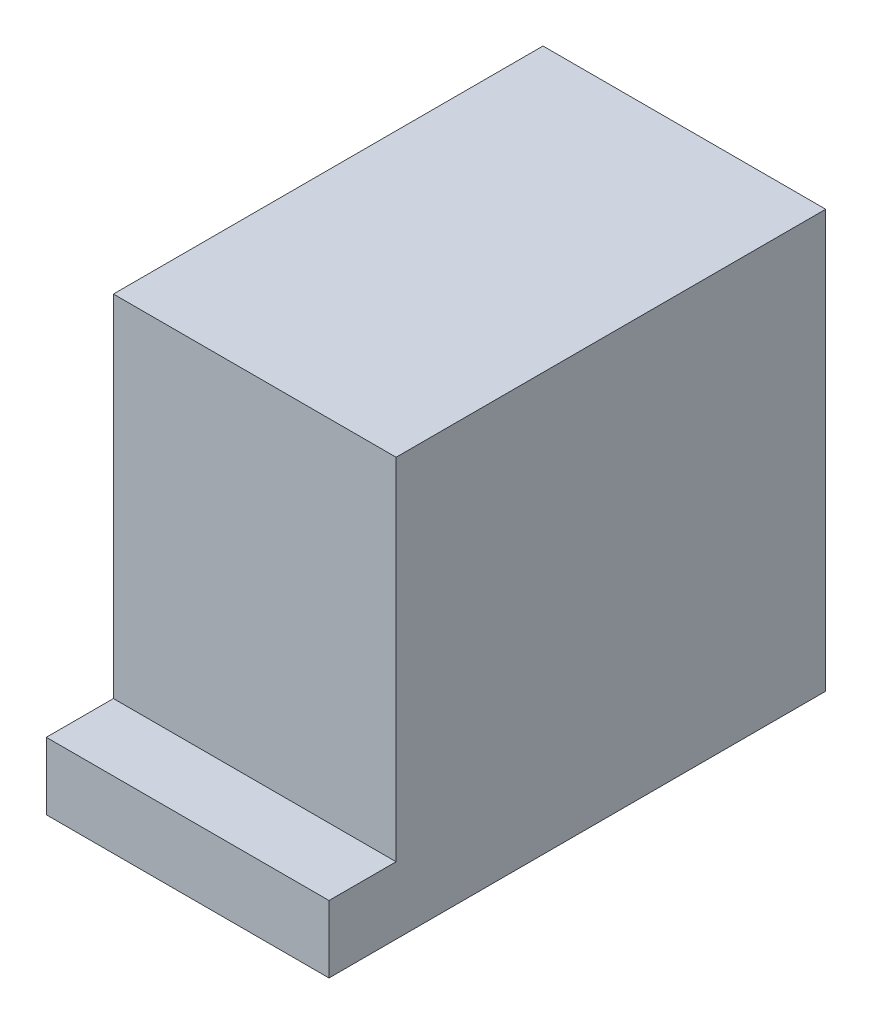
from build123d import *

# Parameters (mm, degrees)
SKETCH1_W           = 214
SKETCH1_H           = 376
BOSS_EXTRUDE1_DEPTH = 50.8
BOSS_EXTRUDE2_START = -50.8
SKETCH2_W           = 214
SKETCH2_H           = 325.2
BOSS_EXTRUDE2_DEPTH = 316


with BuildPart() as part:
    # Sketch1 → Boss-Extrude1 (new body)
    with BuildSketch(Plane(origin=(0, 0, 0), x_dir=(1, 0, 0), z_dir=(0, 1, 0))):
        Rectangle(SKETCH1_W, SKETCH1_H)
    extrude(amount=BOSS_EXTRUDE1_DEPTH)

    # Sketch2 → Boss-Extrude2 (add)
    with BuildSketch(Plane(origin=(0, 50.8, 0), x_dir=(1, 0, 0), z_dir=(0, 1, 0)).offset(BOSS_EXTRUDE2_START)):
        with Locations((0, 25.4)):
            Rectangle(SKETCH2_W, SKETCH2_H)
    extrude(amount=BOSS_EXTRUDE2_DEPTH)


solid = part.part
